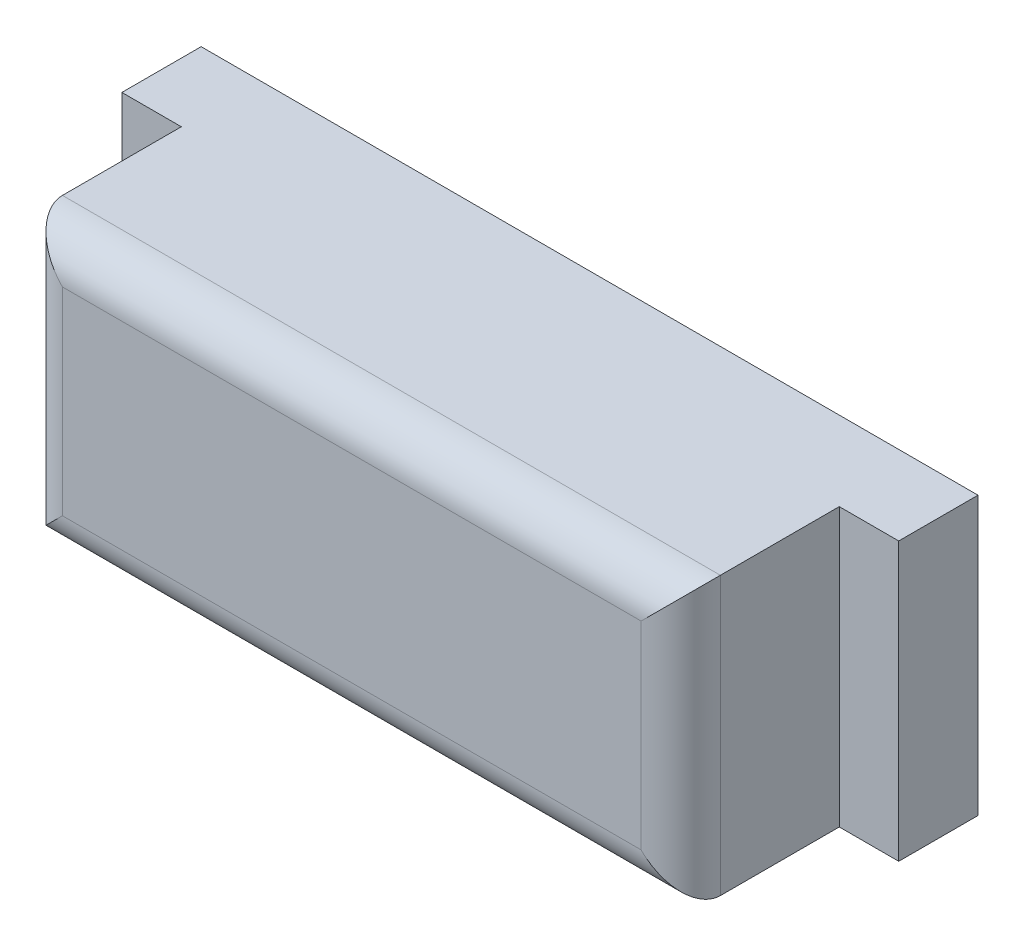
from build123d import *

# Parameters (mm, degrees)
SKETCH_1_W      = 9.8
SKETCH_1_H      = 3.5
EXTRUDE_1_DEPTH = 1
SKETCH_2_W      = 8.3
SKETCH_2_H      = 3.5
EXTRUDE_2_DEPTH = 2
FILLET_2_R      = 0.5


with BuildPart() as part:
    # 草图1 → 凸台-拉伸1 (new body)
    with BuildSketch(Plane.XY):
        Rectangle(SKETCH_1_W, SKETCH_1_H)
    extrude(amount=EXTRUDE_1_DEPTH)

    # 草图2 → 凸台-拉伸2 (add)
    with BuildSketch(Plane.XY.offset(1)):
        Rectangle(SKETCH_2_W, SKETCH_2_H)
    extrude(amount=EXTRUDE_2_DEPTH)

    # 圆角2
    fillet_2_edges = [part.edges().sort_by_distance(p)[0] for p in [
        (4.15, 0, 3),
        (0, 1.75, 3),
        (-4.15, 0, 3),
        (0, -1.75, 3),
    ]]
    fillet(fillet_2_edges, radius=FILLET_2_R)


solid = part.part
